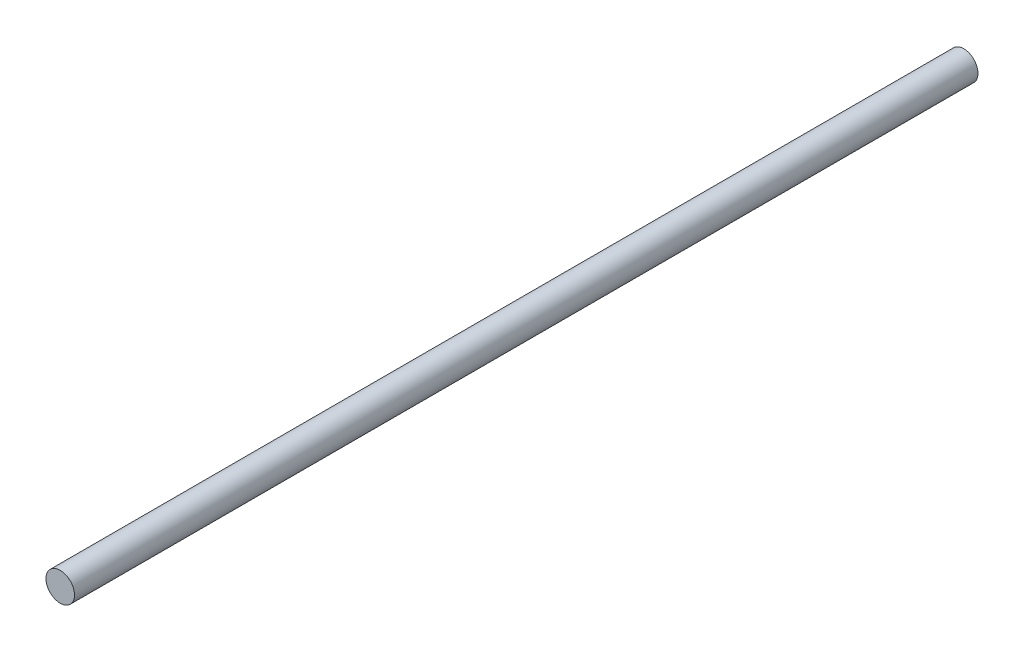
from build123d import *

# Parameters (mm, degrees)
SKETCH1_R           = 3
BOSS_EXTRUDE1_DEPTH = 190


with BuildPart() as part:
    # Sketch1 → Boss-Extrude1 (new body)
    with BuildSketch(Plane.XY):
        Circle(SKETCH1_R)
    extrude(amount=BOSS_EXTRUDE1_DEPTH)


solid = part.part
